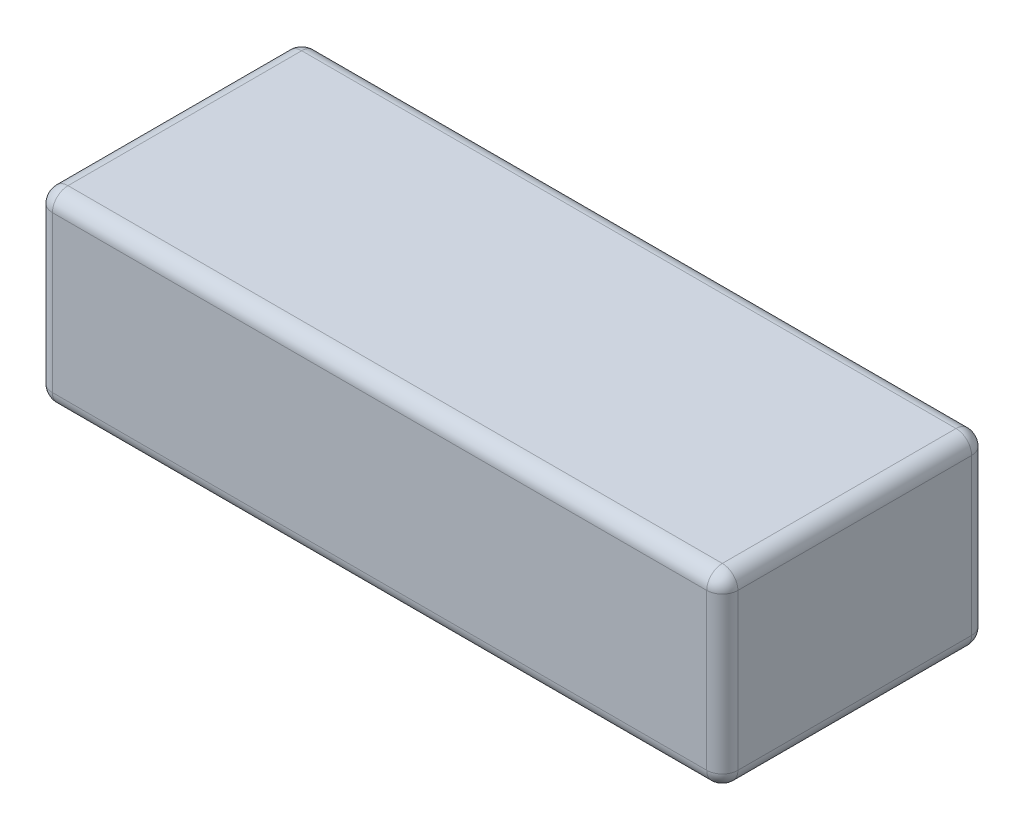
from build123d import *

# Parameters (mm, degrees)
SKETCH1_W           = 44
SKETCH1_H           = 17
BOSS_EXTRUDE1_DEPTH = 12
FILLET1_R           = 1
SKETCH2_W           = 40
SKETCH2_H           = 13
BOSS_EXTRUDE2_DEPTH = 0.6


with BuildPart() as part:
    # Sketch1 → Boss-Extrude1 (new body)
    with BuildSketch(Plane(origin=(0, 0, 0), x_dir=(1, 0, 0), z_dir=(0, 1, 0))):
        Rectangle(SKETCH1_W, SKETCH1_H)
    extrude(amount=BOSS_EXTRUDE1_DEPTH)

    # Fillet1
    fillet1_edges = [part.edges().sort_by_distance(p)[0] for p in [
        (-22, 12, 0),
        (0, 12, 8.5),
        (22, 12, 0),
        (0, 0, 8.5),
        (-22, 0, 0),
        (0, 0, -8.5),
        (22, 0, 0),
        (22, 6, 8.5),
        (-22, 6, 8.5),
        (-22, 6, -8.5),
        (22, 6, -8.5),
        (0, 12, -8.5),
    ]]
    fillet(fillet1_edges, radius=FILLET1_R)

    # Sketch2 → Boss-Extrude2 (add)
    with BuildSketch(Plane.XZ):
        Rectangle(SKETCH2_W, SKETCH2_H)
    extrude(amount=BOSS_EXTRUDE2_DEPTH)


solid = part.part
